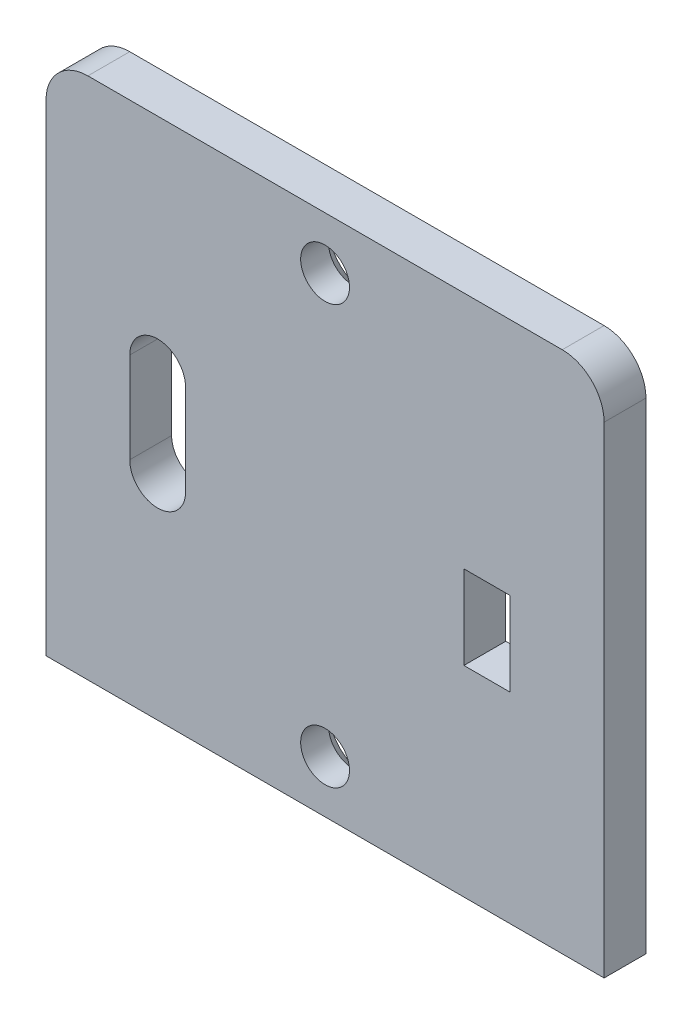
from build123d import *

# Parameters (mm, degrees)
ESQUISSE1_W             = 40
ESQUISSE1_H             = 37.5
ESQUISSE1_R             = 1.75
BOSS_EXTRU_1_DEPTH      = 3
CHANFREIN1_SIZE         = 1
CONG_1_R                = 3
ESQUISSE5_W             = 3.3
ESQUISSE5_H             = 6
ENL_V_MAT_EXTRU_2_DEPTH = 42.208509496
ESQUISSE6_R             = 1
BOSS_EXTRU_2_DEPTH      = 2


with BuildPart() as part:
    # Esquisse1 → Boss.-Extru.1 (new body)
    with BuildSketch(Plane.XY):
        with Locations((-10.738255034, 8.531879195)):
            Rectangle(ESQUISSE1_W, ESQUISSE1_H)
        with Locations((-10.738255034, -6.468120805)):
            Circle(ESQUISSE1_R, mode=Mode.SUBTRACT)
        with Locations((-10.738255034, 23.531879195)):
            Circle(ESQUISSE1_R, mode=Mode.SUBTRACT)
    extrude(amount=BOSS_EXTRU_1_DEPTH)

    # Chanfrein1
    chanfrein1_edges = [part.edges().sort_by_distance(p)[0] for p in [
        (-12.488255034, -6.468120805, 0),
        (-12.488255034, 23.531879195, 0),
    ]]
    chamfer(chanfrein1_edges, length=CHANFREIN1_SIZE)

    # Congé1
    cong_1_edges = [part.edges().sort_by_distance(p)[0] for p in [
        (-30.738255034, 27.281879195, 1.5),
        (9.261744966, 27.281879195, 1.5),
    ]]
    fillet(cong_1_edges, radius=CONG_1_R)

    # Esquisse5 → Enlèv. mat.-Extru.2 (cut, through all)
    with BuildSketch(Plane(origin=(0, 0, 0), x_dir=(-1, 0, 0), z_dir=(0, 0, -1))):
        with BuildLine():
            Line((24.738255034, 11.451981866), (24.738255034, 4.951981866))
            ThreePointArc((24.738255034, 4.951981866), (22.738255034, 2.951981866), (20.738255034, 4.951981866))
            Line((20.738255034, 4.951981866), (20.738255034, 11.451981866))
            ThreePointArc((20.738255034, 11.451981866), (22.738255034, 13.451981866), (24.738255034, 11.451981866))
        make_face()
        with Locations((-0.860681094, 7.158115812)):
            Rectangle(ESQUISSE5_W, ESQUISSE5_H)
    extrude(amount=-ENL_V_MAT_EXTRU_2_DEPTH, mode=Mode.SUBTRACT)

    # Esquisse6 → Boss.-Extru.2 (add)
    with BuildSketch(Plane(origin=(0, 0, 0), x_dir=(-1, 0, 0), z_dir=(0, 0, -1))):
        with Locations(Location((-0.860681094, 15.158115812, 0), (0, 0, 180))):
            Circle(ESQUISSE6_R)
        with Locations(Location((-0.860681094, -0.841884188, 0), (0, 0, 180))):
            Circle(ESQUISSE6_R)
    extrude(amount=BOSS_EXTRU_2_DEPTH)


solid = part.part
